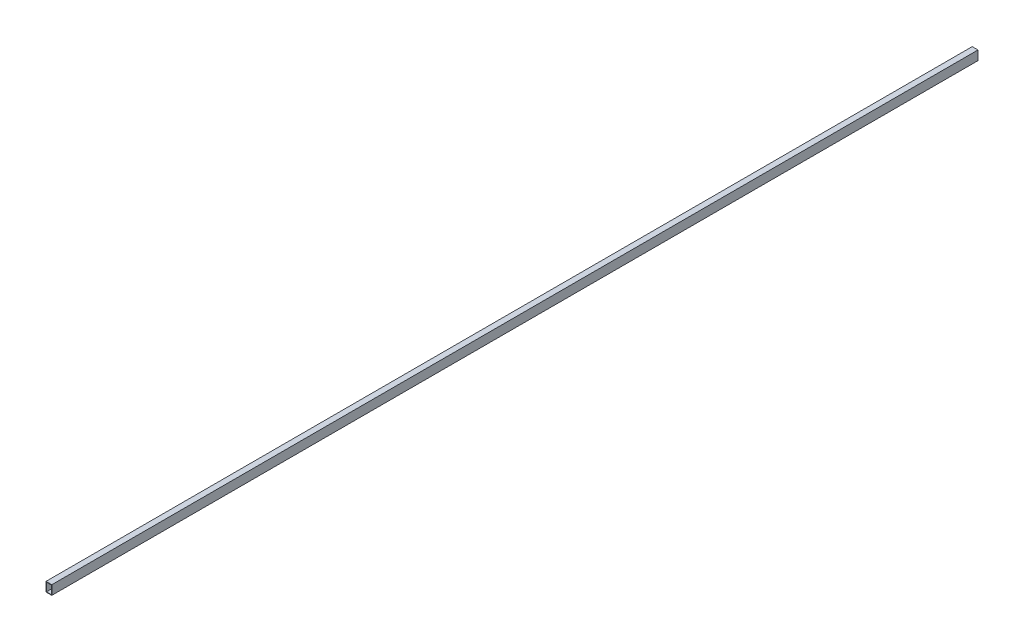
from build123d import *

# Parameters (mm, degrees)
SKETCH1_W           = 50
SKETCH1_H           = 80
BOSS_EXTRUDE1_DEPTH = 8000
SKETCH2_W           = 42
SKETCH2_H           = 72
CUT_EXTRUDE1_DEPTH  = 8000


with BuildPart() as part:
    # Sketch1 → Boss-Extrude1 (new body)
    with BuildSketch(Plane.XY):
        Rectangle(SKETCH1_W, SKETCH1_H)
    extrude(amount=BOSS_EXTRUDE1_DEPTH)

    # Sketch2 → Cut-Extrude1 (cut)
    with BuildSketch(Plane(origin=(0, 0, 0), x_dir=(-1, 0, 0), z_dir=(0, 0, -1))):
        Rectangle(SKETCH2_W, SKETCH2_H)
    extrude(amount=-CUT_EXTRUDE1_DEPTH, mode=Mode.SUBTRACT)


solid = part.part
